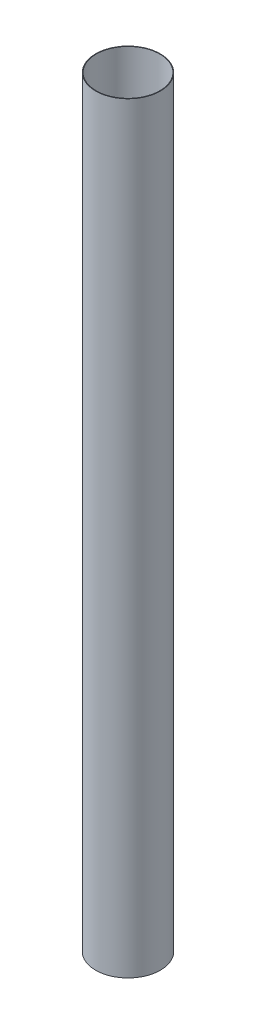
from build123d import *

# Parameters (mm, degrees)
SKETCH1_R           = 30.5
SKETCH1_R_2         = 30
BOSS_EXTRUDE1_DEPTH = 718


with BuildPart() as part:
    # Sketch1 → Boss-Extrude1 (new body)
    with BuildSketch(Plane(origin=(0, 0, 0), x_dir=(1, 0, 0), z_dir=(0, 1, 0))):
        with Locations(Location((0, 0, 0), (0, 0, 270))):
            Circle(SKETCH1_R)
        with Locations(Location((0, 0, 0), (0, 0, 270))):
            Circle(SKETCH1_R_2, mode=Mode.SUBTRACT)
    extrude(amount=BOSS_EXTRUDE1_DEPTH)


solid = part.part
